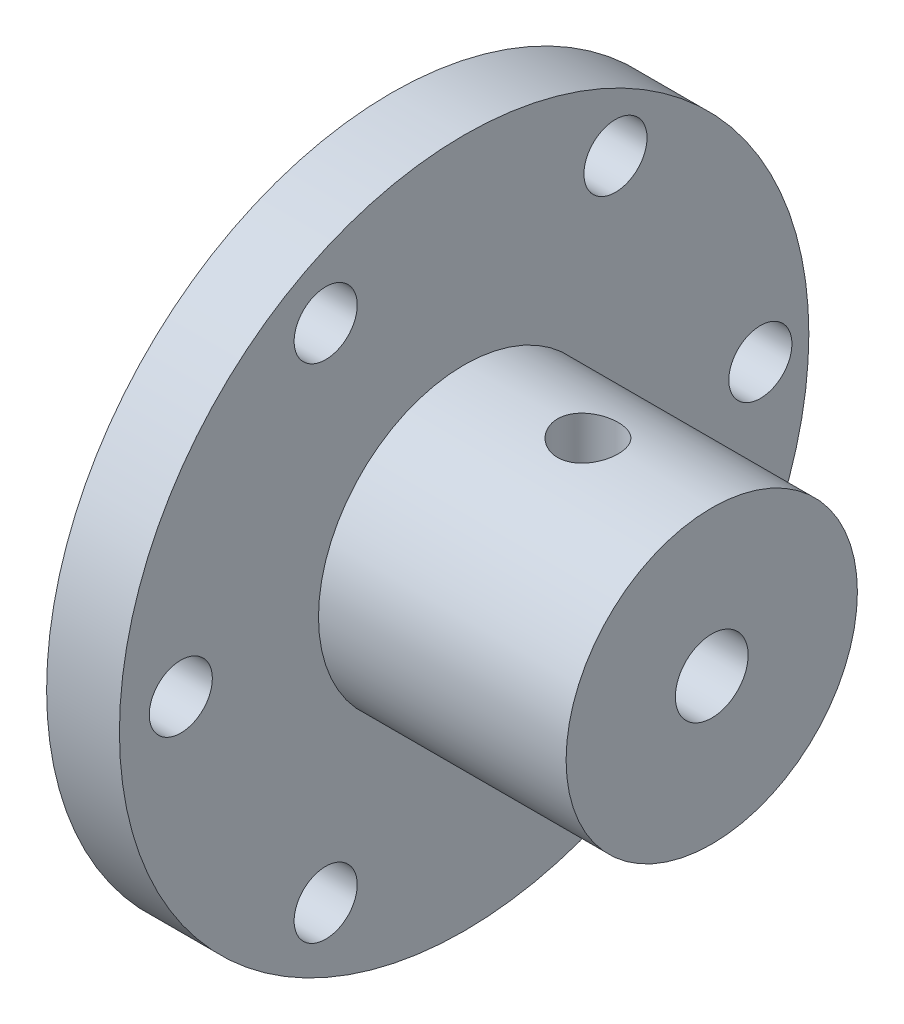
from build123d import *

# Parameters (mm, degrees)
ESQUISSE2_R             = 2.6
ENL_V_MAT_EXTRU_1_DEPTH = 10
ESQUISSE3_R             = 2.5
ENL_V_MAT_EXTRU_2_DEPTH = 10


with BuildPart() as part:
    # Esquisse1 → Révolution1 (revolve)
    with BuildSketch(Plane.XY, mode=Mode.PRIVATE) as r_volution1_sk:
        Polygon((-39.661027285, 12), (-60.061027285, 12), (-60.061027285, 28.4), (-66.061027285, 28.4), (-66.061027285, 3), (-39.661027285, 3), align=None)
    revolve(r_volution1_sk.sketch.rotate(Axis((54.367533201, 0, 0), (-1, 0, 0)), 90), axis=Axis((54.367533201, 0, 0), (-1, 0, 0)))

    # Esquisse2 → Enlèv. mat.-Extru.1 (cut)
    with BuildSketch(Plane(origin=(-60.061027285, 0, 0), x_dir=(0, 0, -1), z_dir=(1, 0, 0))):
        with Locations((-23.344444301, 0)):
            Circle(ESQUISSE2_R)
        with Locations((-11.406944301, 20.676356515)):
            Circle(ESQUISSE2_R)
        with Locations((12.468055699, 20.676356515)):
            Circle(ESQUISSE2_R)
        with Locations((24.405555699, 0)):
            Circle(ESQUISSE2_R)
        with Locations((12.468055699, -20.676356515)):
            Circle(ESQUISSE2_R)
        with Locations((-11.406944301, -20.676356515)):
            Circle(ESQUISSE2_R)
    extrude(amount=-ENL_V_MAT_EXTRU_1_DEPTH, mode=Mode.SUBTRACT)

    # Esquisse3 → Enlèv. mat.-Extru.2 (cut)
    with BuildSketch(Plane(origin=(0, 12, 0), x_dir=(-1, 0, 0), z_dir=(0, -1, 0))):
        with Locations((49.861027285, 0)):
            Circle(ESQUISSE3_R)
    extrude(amount=ENL_V_MAT_EXTRU_2_DEPTH, mode=Mode.SUBTRACT)


solid = part.part
